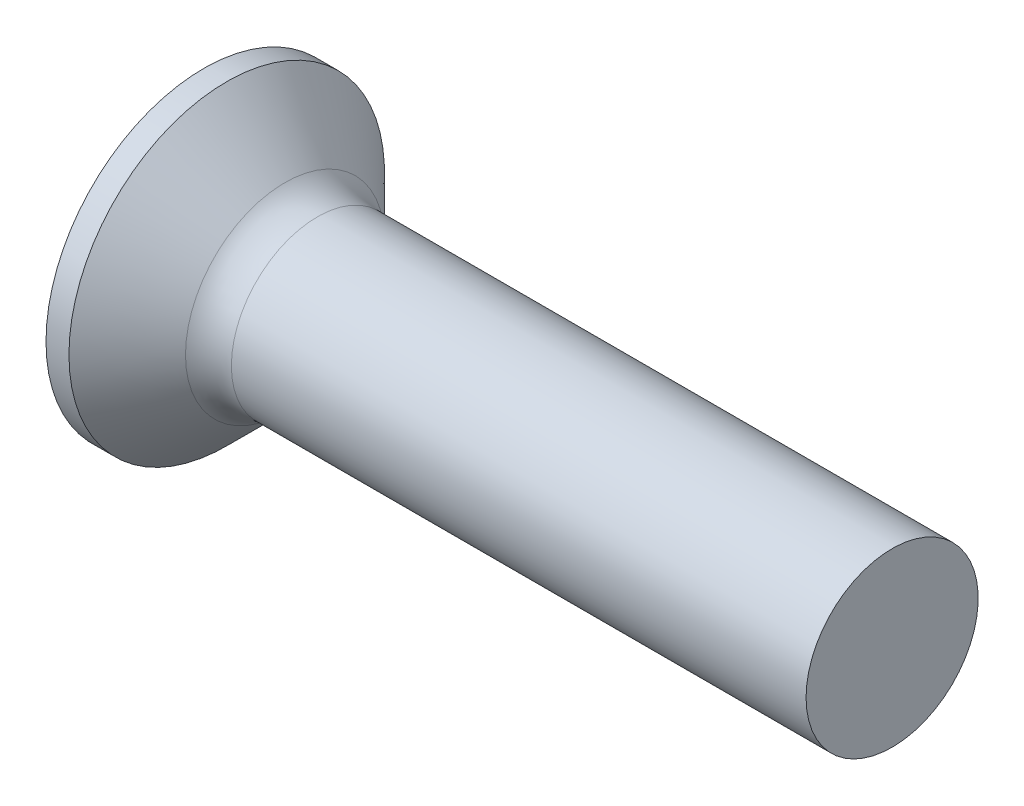
from build123d import *

# Parameters (mm, degrees)
FILLET1_R    = 0.8
RECPAT_COUNT = 2
RECPAT_ANGLE = 90


with BuildPart() as part:
    # BodySke → Base-Revolve (revolve)
    with BuildSketch(Plane.XY, mode=Mode.PRIVATE) as base_revolve_sk:
        Polygon((0, 0), (0, 2.75), (0.4, 2.75), (1.65, 1.5), (12, 1.5), (12, 0), align=None)
    revolve(base_revolve_sk.sketch.rotate(Axis((-6.35, 0, 0), (1, 0, 0)), 90), axis=Axis((-6.35, 0, 0), (1, 0, 0)))

    # Fillet1
    fillet1_edges = [part.edges().sort_by_distance(p)[0] for p in [
        (1.65, 0, -1.5),
    ]]
    fillet(fillet1_edges, radius=FILLET1_R)

    # Sketch3 → Recess section 0
    with BuildSketch(Plane.ZY):
        with BuildLine():
            Line((-0.37, 1.5), (0.37, 1.5))
            Line((0.37, 1.5), (0.37, -1.5))
            Line((0.37, -1.5), (-0.37, -1.5))
            Line((-0.37, -1.5), (-0.37, 1.5))
        make_face()
    # Sketch4 → Recess section 1
    with BuildSketch(Plane.ZY.offset(-2.01)):
        with BuildLine():
            Line((-0.37, 0.497851135), (0.37, 0.497851135))
            Line((0.37, 0.497851135), (0.37, -0.497851135))
            Line((0.37, -0.497851135), (-0.37, -0.497851135))
            Line((-0.37, -0.497851135), (-0.37, 0.497851135))
        make_face()
    recess = loft(mode=Mode.SUBTRACT)

    # RecPat: Recess ×2 about axis
    recpat_axis = Axis((0, 0, 0), (1, 0, 0))
    for i in range(1, RECPAT_COUNT):
        add(recess.rotate(recpat_axis, i * RECPAT_ANGLE / (RECPAT_COUNT - 1)), mode=Mode.SUBTRACT)

    # RecCorSke → RecessCore (revolve, cut)
    with BuildSketch(Plane.XY, mode=Mode.PRIVATE) as recesscore_sk:
        Polygon((0, 0), (0, 0.696552892), (2.01, 0.556), (2.190655351, 0), align=None)
    revolve(recesscore_sk.sketch.rotate(Axis((-3.175, 0, 0), (1, 0, 0)), 90), axis=Axis((-3.175, 0, 0), (1, 0, 0)), mode=Mode.SUBTRACT)


solid = part.part
